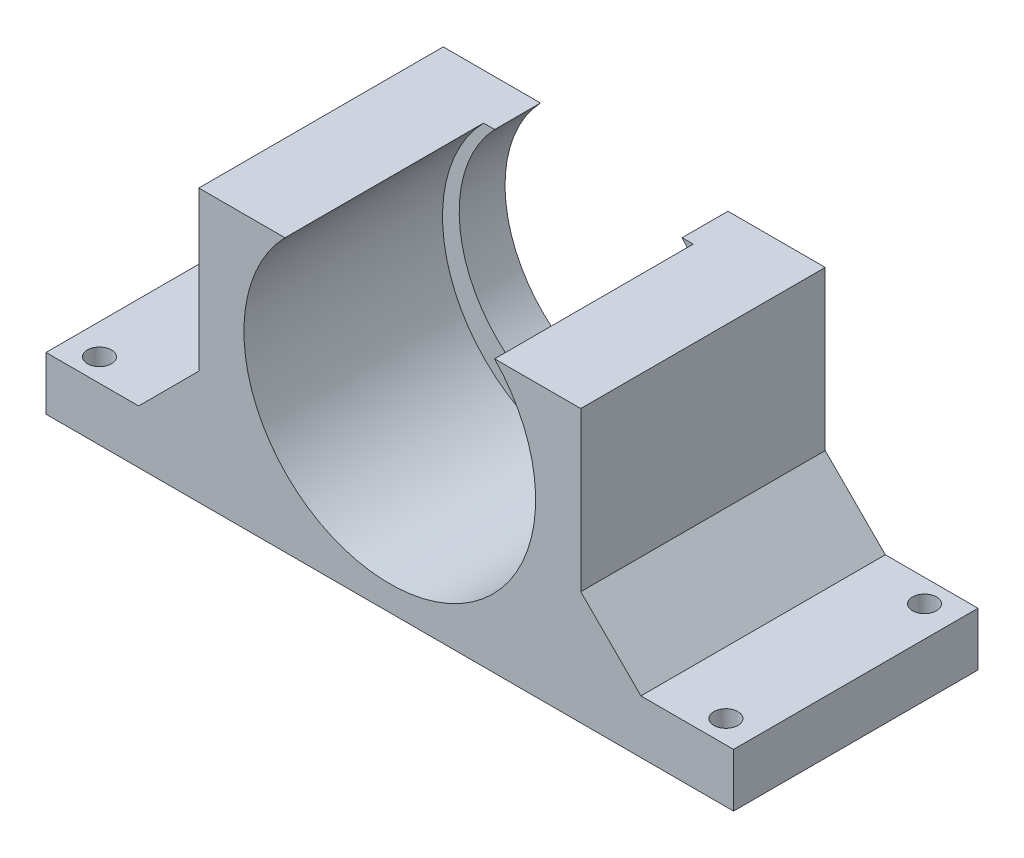
from build123d import *

# Parameters (mm, degrees)
SKETCH1_W           = 63.5
SKETCH1_H           = 60.96
BOSS_EXTRUDE1_DEPTH = 40.64
SKETCH2_R           = 24.25
CUT_EXTRUDE1_DEPTH  = 33.02
SKETCH8_W           = 63.5
SKETCH8_H           = 40.64
CUT_EXTRUDE3_DEPTH  = 15.6972
SKETCH16_W          = 25.4
SKETCH16_H          = 40.64
BOSS_EXTRUDE5_DEPTH = 8.89
SKETCH17_R          = 2
CUT_EXTRUDE5_DEPTH  = 79.998181497
SKETCH11_R          = 21.478557246
CUT_EXTRUDE6_DEPTH  = 77.464125575
CHAMFER1_SIZE       = 10


with BuildPart() as part:
    # Sketch1 → Boss-Extrude1 (new body)
    with BuildSketch(Plane.XY):
        Rectangle(SKETCH1_W, SKETCH1_H)
    extrude(amount=BOSS_EXTRUDE1_DEPTH)

    # Sketch2 → Cut-Extrude1 (cut)
    with BuildSketch(Plane.XY.offset(40.64)):
        with Locations((0, -2.08)):
            Circle(SKETCH2_R)
    extrude(amount=-CUT_EXTRUDE1_DEPTH, mode=Mode.SUBTRACT)

    # Sketch8 → Cut-Extrude3 (cut)
    with BuildSketch(Plane(origin=(0, 30.48, 0), x_dir=(1, 0, 0), z_dir=(0, 1, 0))):
        with Locations((0, -20.32)):
            Rectangle(SKETCH8_W, SKETCH8_H)
    extrude(amount=-CUT_EXTRUDE3_DEPTH, mode=Mode.SUBTRACT)

    # Sketch16 → Boss-Extrude5 (add)
    with BuildSketch(Plane.XZ.offset(30.48)):
        with Locations((-44.45, 20.32)):
            Rectangle(SKETCH16_W, SKETCH16_H)
        with Locations((44.45, 20.32)):
            Rectangle(SKETCH16_W, SKETCH16_H)
    extrude(amount=-BOSS_EXTRUDE5_DEPTH)

    # Sketch17 → Cut-Extrude5 (cut, through all)
    with BuildSketch(Plane(origin=(0, -21.59, 0), x_dir=(1, 0, 0), z_dir=(0, 1, 0))):
        with Locations(Location((-52.07, -3.81, 0), (0, 0, 270))):
            Circle(SKETCH17_R)
        with Locations(Location((-52.07, -36.83, 0), (0, 0, 270))):
            Circle(SKETCH17_R)
        with Locations(Location((52.07, -3.81, 0), (0, 0, 270))):
            Circle(SKETCH17_R)
        with Locations(Location((52.07, -36.83, 0), (0, 0, 270))):
            Circle(SKETCH17_R)
    extrude(amount=-CUT_EXTRUDE5_DEPTH, mode=Mode.SUBTRACT)

    # Sketch11 → Cut-Extrude6 (cut, through all)
    with BuildSketch(Plane(origin=(0, 0, 0), x_dir=(-1, 0, 0), z_dir=(0, 0, -1))):
        Circle(SKETCH11_R)
    extrude(amount=-CUT_EXTRUDE6_DEPTH, mode=Mode.SUBTRACT)

    # Chamfer1
    chamfer1_edges = [part.edges().sort_by_distance(p)[0] for p in [
        (-31.75, -21.59, 20.32),
        (31.75, -21.59, 20.32),
    ]]
    chamfer(chamfer1_edges, length=CHAMFER1_SIZE)


solid = part.part
